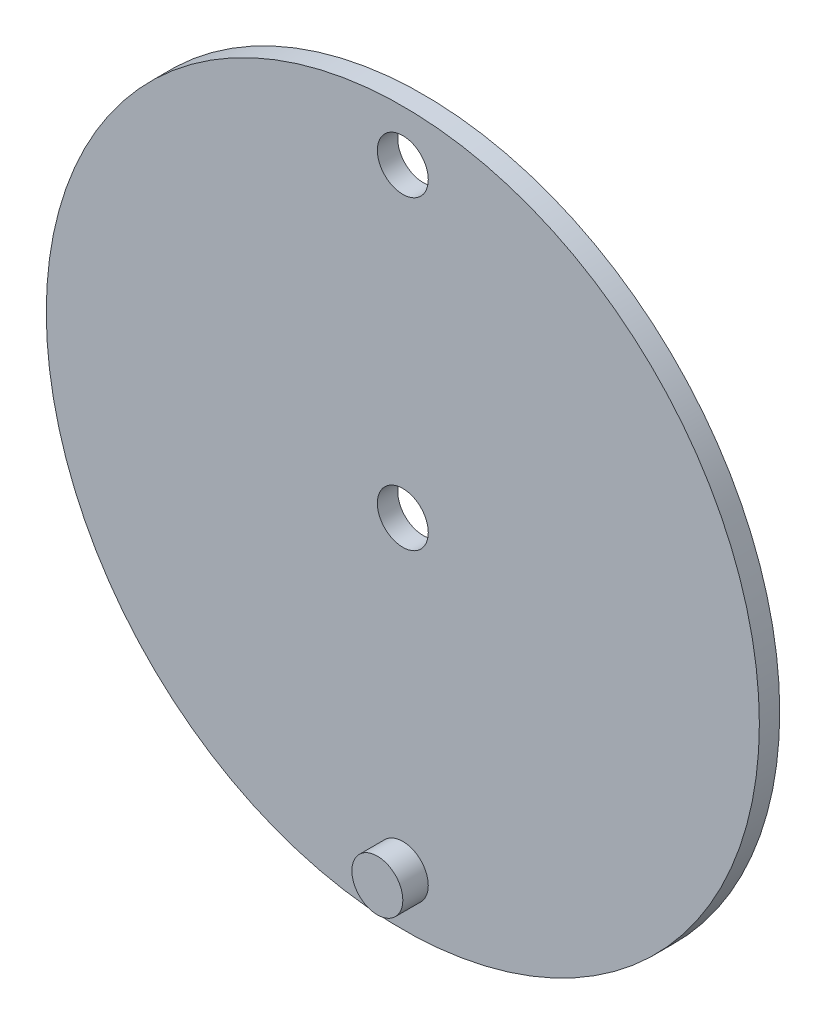
from build123d import *

# Parameters (mm, degrees)
SKETCH1_R           = 88.9
SKETCH1_R_2         = 6.35
BOSS_EXTRUDE1_DEPTH = 5.08
SKETCH2_R           = 6.35
BOSS_EXTRUDE2_DEPTH = 11.43


with BuildPart() as part:
    # Sketch1 → Boss-Extrude1 (new body)
    with BuildSketch(Plane.XY):
        Circle(SKETCH1_R)
        Circle(SKETCH1_R_2, mode=Mode.SUBTRACT)
        with Locations((0, -76.2)):
            Circle(SKETCH1_R_2, mode=Mode.SUBTRACT)
        with Locations((0, 76.2)):
            Circle(SKETCH1_R_2, mode=Mode.SUBTRACT)
    extrude(amount=BOSS_EXTRUDE1_DEPTH)

    # Sketch2 → Boss-Extrude2 (add)
    with BuildSketch(Plane.XY):
        with Locations((0, -76.2)):
            Circle(SKETCH2_R)
    extrude(amount=BOSS_EXTRUDE2_DEPTH)


solid = part.part
